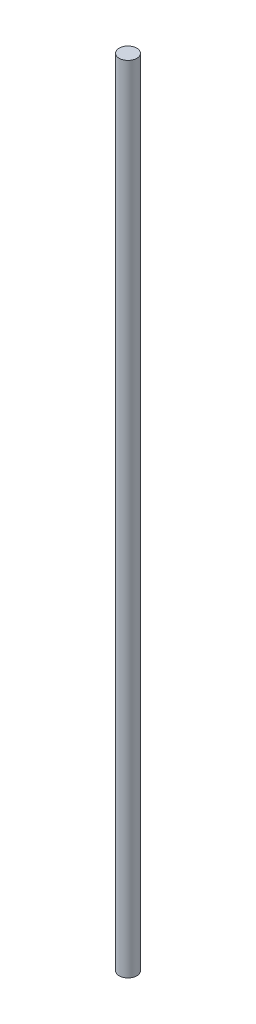
from build123d import *

# Parameters (mm, degrees)
BOSS_EXTRUDE1_DEPTH      = 180
BOSS_EXTRUDE1_DEPTH_BACK = 180
SKETCH1_R                = 4


with BuildPart() as part:
    # Sketch1 → Boss-Extrude1 (new, two sides: drawn at the far end of the back side and taken through both)
    with BuildSketch(Plane(origin=(0, 0, 0), x_dir=(1, 0, 0), z_dir=(0, 1, 0)).offset(-BOSS_EXTRUDE1_DEPTH_BACK)):
        Circle(SKETCH1_R)
    extrude(amount=BOSS_EXTRUDE1_DEPTH + BOSS_EXTRUDE1_DEPTH_BACK)


solid = part.part
